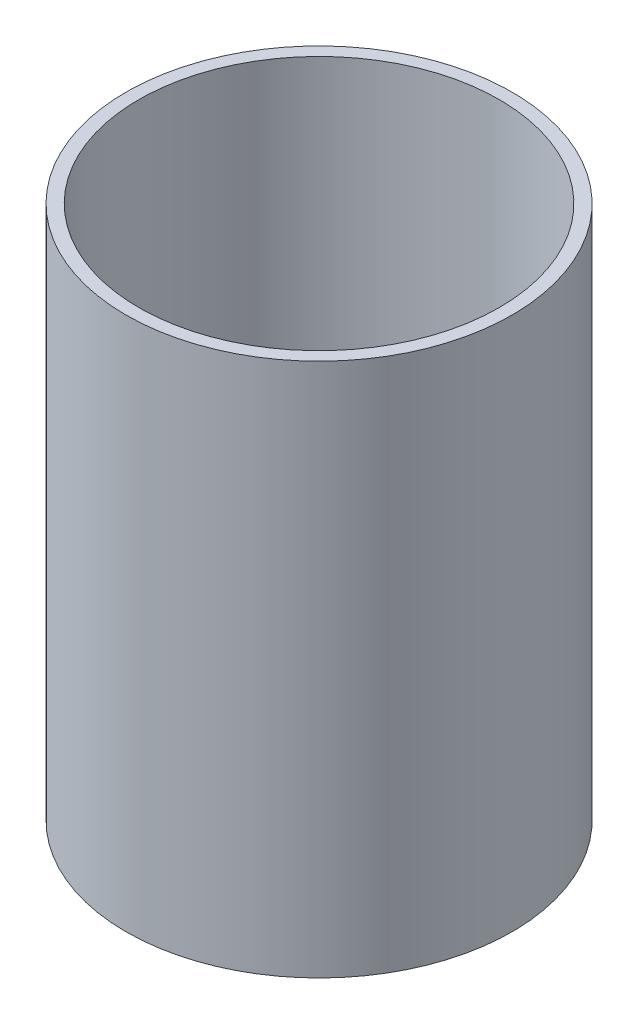
from build123d import *

# Parameters (mm, degrees)
SKETCH_1_R        = 30
EXTRUDE_1_DEPTH   = 3
SKETCH_2_R        = 30
SKETCH_2_R_2      = 28
EXTRUDE_1_2_DEPTH = 80


with BuildPart() as part:
    # 草图1 → Extrude 1 (new body)
    with BuildSketch(Plane(origin=(0, 0, 0), x_dir=(1, 0, 0), z_dir=(0, 1, 0))):
        with Locations(Location((0, 0, 0), (0, 0, 270))):
            Circle(SKETCH_1_R)
    extrude(amount=EXTRUDE_1_DEPTH)

    # 草图2 → Extrude 1 2 (add)
    with BuildSketch(Plane(origin=(0, 3, 0), x_dir=(1, 0, 0), z_dir=(0, 1, 0))):
        Circle(SKETCH_2_R)
        Circle(SKETCH_2_R_2, mode=Mode.SUBTRACT)
    extrude(amount=EXTRUDE_1_2_DEPTH)


solid = part.part
